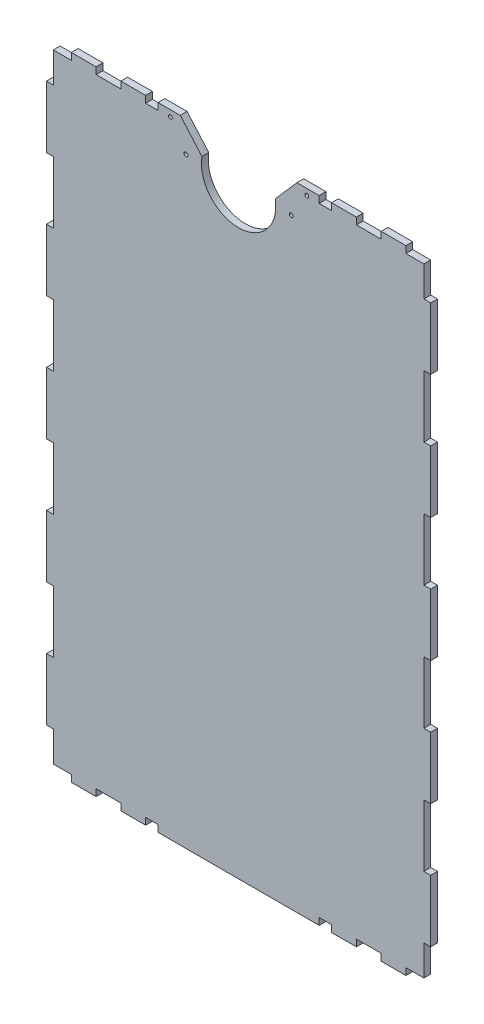
from build123d import *

# Parameters (mm, degrees)
SKETCH_1_W          = 310
SKETCH_1_H          = 510
EXTRUDE_1_DEPTH     = 5.5
SKETCH_2_W          = 5.5
SKETCH_2_H          = 50
CUT_EXTRUDE_1_DEPTH = 299.463146804
CUT_EXTRUDE_2_DEPTH = 299.463146804
SKETCH_5_R          = 1.6
CUT_EXTRUDE_3_DEPTH = 299.463146804
SKETCH_6_R          = 1.55
CUT_EXTRUDE_4_DEPTH = 299.463146804
SKETCH_7_W          = 20
SKETCH_7_H          = 5.5
SKETCH_7_W_2        = 10
CUT_EXTRUDE_5_DEPTH = 299.463146804


with BuildPart() as part:
    # ｽｹｯﾁ1 → ﾎﾞｽ - 押し出し1 (new body)
    with BuildSketch(Plane.XY):
        Rectangle(SKETCH_1_W, SKETCH_1_H)
    extrude(amount=EXTRUDE_1_DEPTH)

    # ｽｹｯﾁ2 → ｶｯﾄ - 押し出し1 (cut, through all)
    with BuildSketch(Plane.XY.offset(5.5)):
        with Locations((152.25, 50)):
            Rectangle(SKETCH_2_W, SKETCH_2_H)
        with Locations((152.25, -50)):
            Rectangle(SKETCH_2_W, SKETCH_2_H)
        with Locations((152.25, 150)):
            Rectangle(SKETCH_2_W, SKETCH_2_H)
        with Locations((152.25, -150)):
            Rectangle(SKETCH_2_W, SKETCH_2_H)
        with Locations((152.25, 250)):
            Rectangle(SKETCH_2_W, SKETCH_2_H)
        with Locations((152.25, -250)):
            Rectangle(SKETCH_2_W, SKETCH_2_H)
        with Locations((-152.25, 50)):
            Rectangle(SKETCH_2_W, SKETCH_2_H)
        with Locations((-152.25, -50)):
            Rectangle(SKETCH_2_W, SKETCH_2_H)
        with Locations((-152.25, 150)):
            Rectangle(SKETCH_2_W, SKETCH_2_H)
        with Locations((-152.25, -150)):
            Rectangle(SKETCH_2_W, SKETCH_2_H)
        with Locations((-152.25, 250)):
            Rectangle(SKETCH_2_W, SKETCH_2_H)
        with Locations((-152.25, -250)):
            Rectangle(SKETCH_2_W, SKETCH_2_H)
    extrude(amount=-CUT_EXTRUDE_1_DEPTH, mode=Mode.SUBTRACT)

    # ｽｹｯﾁ3 → ｶｯﾄ - 押し出し2 (cut, through all)
    with BuildSketch(Plane.XY.offset(5.5)):
        with BuildLine():
            Line((47.033321686, 255), (29.580398915, 235))
            ThreePointArc((29.580398915, 235), (0, 200), (-29.580398915, 235))
            Line((-29.580398915, 235), (-47.033321686, 255))
            Line((-47.033321686, 255), (47.033321686, 255))
        make_face()
    extrude(amount=-CUT_EXTRUDE_2_DEPTH, mode=Mode.SUBTRACT)

    # ｽｹｯﾁ5 → ｶｯﾄ - 押し出し3 (cut, through all)
    with BuildSketch(Plane.XY.offset(5.5)):
        with Locations((-42.5, 230)):
            Circle(SKETCH_5_R)
        with Locations((42.5, 230)):
            Circle(SKETCH_5_R)
    extrude(amount=-CUT_EXTRUDE_3_DEPTH, mode=Mode.SUBTRACT)

    # ｽｹｯﾁ6 → ｶｯﾄ - 押し出し4 (cut, through all)
    with BuildSketch(Plane.XY.offset(5.5)):
        with Locations((55, 250)):
            Circle(SKETCH_6_R)
        with Locations((-55, 250)):
            Circle(SKETCH_6_R)
    extrude(amount=-CUT_EXTRUDE_4_DEPTH, mode=Mode.SUBTRACT)

    # ｽｹｯﾁ7 → ｶｯﾄ - 押し出し5 (cut, through all)
    with BuildSketch(Plane.XY.offset(5.5)):
        with Locations((145, 252.25)):
            Rectangle(SKETCH_7_W, SKETCH_7_H)
        with Locations((105, 252.25)):
            Rectangle(SKETCH_7_W, SKETCH_7_H)
        with Locations((70, 252.25)):
            Rectangle(SKETCH_7_W_2, SKETCH_7_H)
        with Locations((-70, 252.25)):
            Rectangle(SKETCH_7_W_2, SKETCH_7_H)
        with Locations((-105, 252.25)):
            Rectangle(SKETCH_7_W, SKETCH_7_H)
        with Locations((-145, 252.25)):
            Rectangle(SKETCH_7_W, SKETCH_7_H)
        with Locations((-145, -252.25)):
            Rectangle(SKETCH_7_W, SKETCH_7_H)
        with Locations((-105, -252.25)):
            Rectangle(SKETCH_7_W, SKETCH_7_H)
        with Locations((-70, -252.25)):
            Rectangle(SKETCH_7_W_2, SKETCH_7_H)
        with Locations((70, -252.25)):
            Rectangle(SKETCH_7_W_2, SKETCH_7_H)
        with Locations((105, -252.25)):
            Rectangle(SKETCH_7_W, SKETCH_7_H)
        with Locations((145, -252.25)):
            Rectangle(SKETCH_7_W, SKETCH_7_H)
    extrude(amount=-CUT_EXTRUDE_5_DEPTH, mode=Mode.SUBTRACT)


solid = part.part
